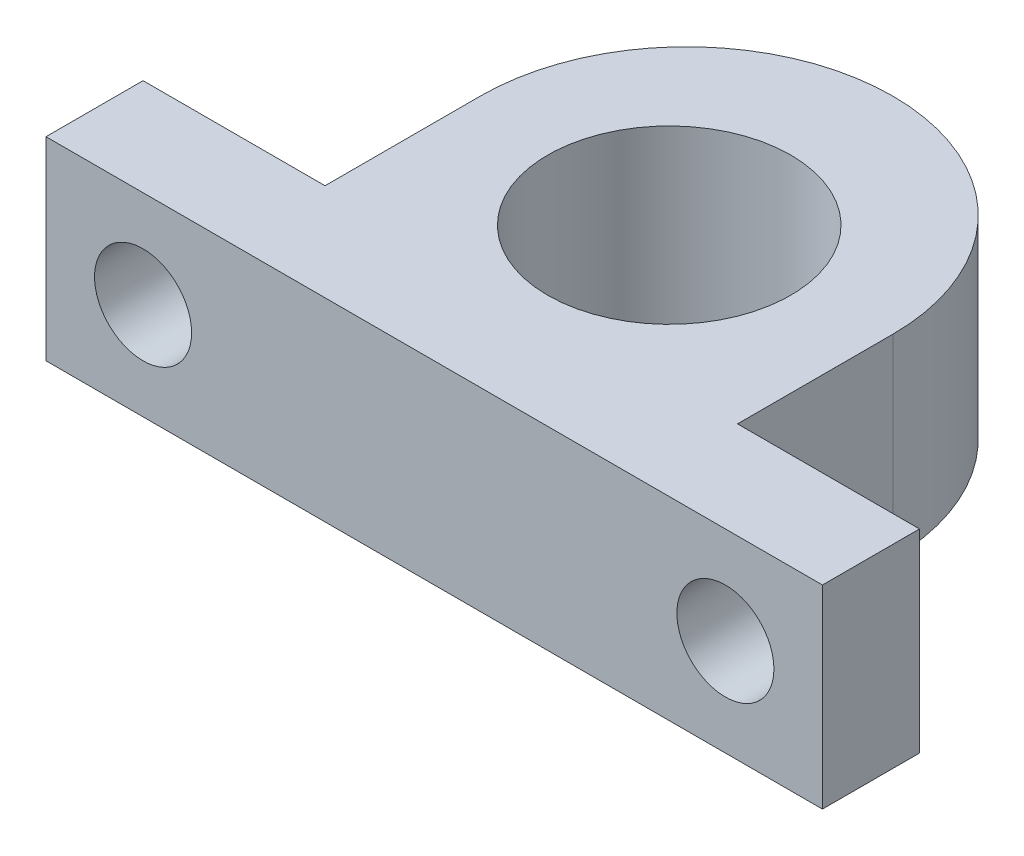
from build123d import *

# Parameters (mm, degrees)
BOSS_EXTRUDE1_DEPTH = 12.7
SKETCH2_R           = 7.9502
CUT_EXTRUDE1_DEPTH  = 42.311923389
SKETCH3_R           = 3.175
CUT_EXTRUDE2_DEPTH  = 42.311923389


with BuildPart() as part:
    # Sketch1 → Boss-Extrude1 (new body)
    with BuildSketch(Plane(origin=(0, 0, 0), x_dir=(1, 0, 0), z_dir=(0, 1, 0))):
        with BuildLine():
            Line((-25.4, 0), (25.4, 0))
            Line((25.4, 0), (25.4, 6.35))
            Line((25.4, 6.35), (13.49375, 6.35))
            Line((13.49375, 6.35), (13.49375, 16.51))
            ThreePointArc((13.49375, 16.51), (0, 30.00375), (-13.49375, 16.51))
            Line((-13.49375, 16.51), (-13.49375, 6.35))
            Line((-13.49375, 6.35), (-25.4, 6.35))
            Line((-25.4, 6.35), (-25.4, 0))
        make_face()
    extrude(amount=BOSS_EXTRUDE1_DEPTH)

    # Sketch2 → Cut-Extrude1 (cut, through all)
    with BuildSketch(Plane(origin=(0, 12.7, 0), x_dir=(1, 0, 0), z_dir=(0, 1, 0))):
        with Locations(Location((0, 15.375414513, 0), (0, 0, 270))):
            Circle(SKETCH2_R)
    extrude(amount=-CUT_EXTRUDE1_DEPTH, mode=Mode.SUBTRACT)

    # Sketch3 → Cut-Extrude2 (cut, through all)
    with BuildSketch(Plane.XY):
        with Locations((-19.05, 6.35)):
            Circle(SKETCH3_R)
        with Locations((19.05, 6.35)):
            Circle(SKETCH3_R)
    extrude(amount=-CUT_EXTRUDE2_DEPTH, mode=Mode.SUBTRACT)


solid = part.part
